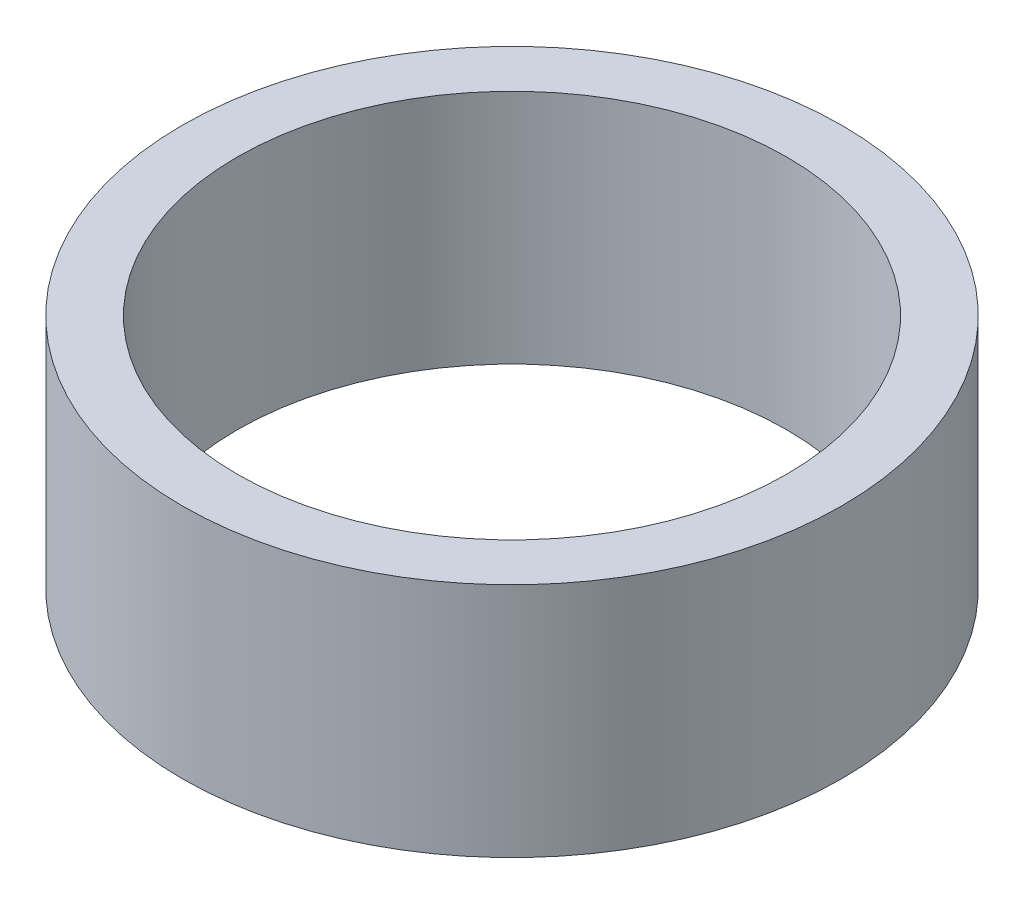
from build123d import *

# Parameters (mm, degrees)
SKETCH1_R           = 60
BOSS_EXTRUDE1_DEPTH = 43
SKETCH2_R           = 50
CUT_EXTRUDE1_DEPTH  = 43


with BuildPart() as part:
    # Sketch1 → Boss-Extrude1 (new body)
    with BuildSketch(Plane(origin=(0, 0, 0), x_dir=(1, 0, 0), z_dir=(0, 1, 0))):
        with Locations(Location((0, 0, 0), (0, 0, 270))):
            Circle(SKETCH1_R)
    extrude(amount=BOSS_EXTRUDE1_DEPTH)

    # Sketch2 → Cut-Extrude1 (cut)
    with BuildSketch(Plane.XZ):
        with Locations(Location((0, 0, 0), (0, 0, 270))):
            Circle(SKETCH2_R)
    extrude(amount=-CUT_EXTRUDE1_DEPTH, mode=Mode.SUBTRACT)


solid = part.part
